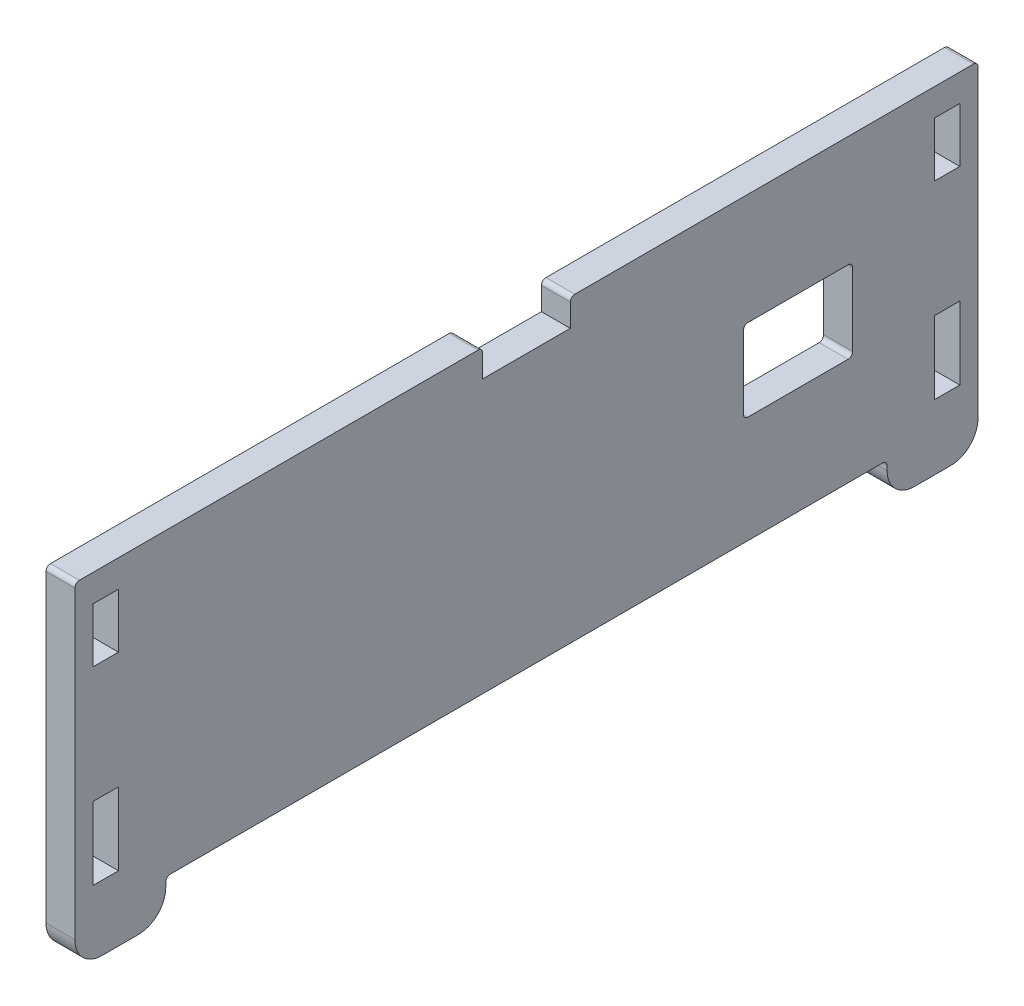
from build123d import *

# Parameters (mm, degrees)
SKETCH1_W           = 99.35
SKETCH1_H           = 37
BOSS_EXTRUDE1_DEPTH = 3.175
SKETCH2_W           = 2.8
SKETCH2_H           = 6
SKETCH2_H_2         = 8
CUT_EXTRUDE1_DEPTH  = 54.103071945
SKETCH3_W           = 79.35
SKETCH3_H           = 4
CUT_EXTRUDE2_DEPTH  = 54.103071945
FILLET1_R           = 3
FILLET2_R           = 0.5
SKETCH4_W           = 9.65
SKETCH4_H           = 3
CUT_EXTRUDE3_DEPTH  = 54.103071945
SKETCH5_W           = 12
SKETCH5_H           = 9
CUT_EXTRUDE4_DEPTH  = 54.103071945
FILLET3_R           = 0.5
FILLET4_R           = 0.5


with BuildPart() as part:
    # Sketch1 → Boss-Extrude1 (new body)
    with BuildSketch(Plane(origin=(0, 0, 0), x_dir=(0, 0, -1), z_dir=(1, 0, 0))):
        Rectangle(SKETCH1_W, SKETCH1_H)
    extrude(amount=BOSS_EXTRUDE1_DEPTH)

    # Sketch2 → Cut-Extrude1 (cut, through all)
    with BuildSketch(Plane(origin=(3.175, 0, 0), x_dir=(0, 0, -1), z_dir=(1, 0, 0))):
        with Locations((-46.275, 12.5)):
            Rectangle(SKETCH2_W, SKETCH2_H)
        with Locations((46.275, 12.5)):
            Rectangle(SKETCH2_W, SKETCH2_H)
        with Locations((-46.275, -7.325)):
            Rectangle(SKETCH2_W, SKETCH2_H_2)
        with Locations((46.275, -7.325)):
            Rectangle(SKETCH2_W, SKETCH2_H_2)
    extrude(amount=-CUT_EXTRUDE1_DEPTH, mode=Mode.SUBTRACT)

    # Sketch3 → Cut-Extrude2 (cut, through all)
    with BuildSketch(Plane(origin=(3.175, 0, 0), x_dir=(0, 0, -1), z_dir=(1, 0, 0))):
        with Locations((0, -16.5)):
            Rectangle(SKETCH3_W, SKETCH3_H)
    extrude(amount=-CUT_EXTRUDE2_DEPTH, mode=Mode.SUBTRACT)

    # Fillet1
    fillet1_edges = [part.edges().sort_by_distance(p)[0] for p in [
        (1.5875, -18.5, -49.675),
        (1.5875, -18.5, 49.675),
        (1.5875, -18.5, 39.675),
        (1.5875, -18.5, -39.675),
    ]]
    fillet(fillet1_edges, radius=FILLET1_R)

    # Fillet2
    fillet2_edges = [part.edges().sort_by_distance(p)[0] for p in [
        (1.5875, 18.5, 49.675),
        (1.5875, 18.5, -49.675),
        (1.5875, -14.5, 39.675),
        (1.5875, -14.5, -39.675),
    ]]
    fillet(fillet2_edges, radius=FILLET2_R)

    # Sketch4 → Cut-Extrude3 (cut, through all)
    with BuildSketch(Plane(origin=(3.175, 0, 0), x_dir=(0, 0, -1), z_dir=(1, 0, 0))):
        with Locations((0, 17)):
            Rectangle(SKETCH4_W, SKETCH4_H)
    extrude(amount=-CUT_EXTRUDE3_DEPTH, mode=Mode.SUBTRACT)

    # Sketch5 → Cut-Extrude4 (cut, through all)
    with BuildSketch(Plane(origin=(3.175, 0, 0), x_dir=(0, 0, -1), z_dir=(1, 0, 0))):
        with Locations((29.875, 1.775)):
            Rectangle(SKETCH5_W, SKETCH5_H)
    extrude(amount=-CUT_EXTRUDE4_DEPTH, mode=Mode.SUBTRACT)

    # Fillet3
    fillet3_edges = [part.edges().sort_by_distance(p)[0] for p in [
        (1.5875, -2.725, -23.875),
        (1.5875, 6.275, -23.875),
        (1.5875, 6.275, -35.875),
        (1.5875, -2.725, -35.875),
    ]]
    fillet(fillet3_edges, radius=FILLET3_R)

    # Fillet4
    fillet4_edges = [part.edges().sort_by_distance(p)[0] for p in [
        (1.5875, 18.5, 4.825),
        (1.5875, 18.5, -4.825),
    ]]
    fillet(fillet4_edges, radius=FILLET4_R)


solid = part.part
